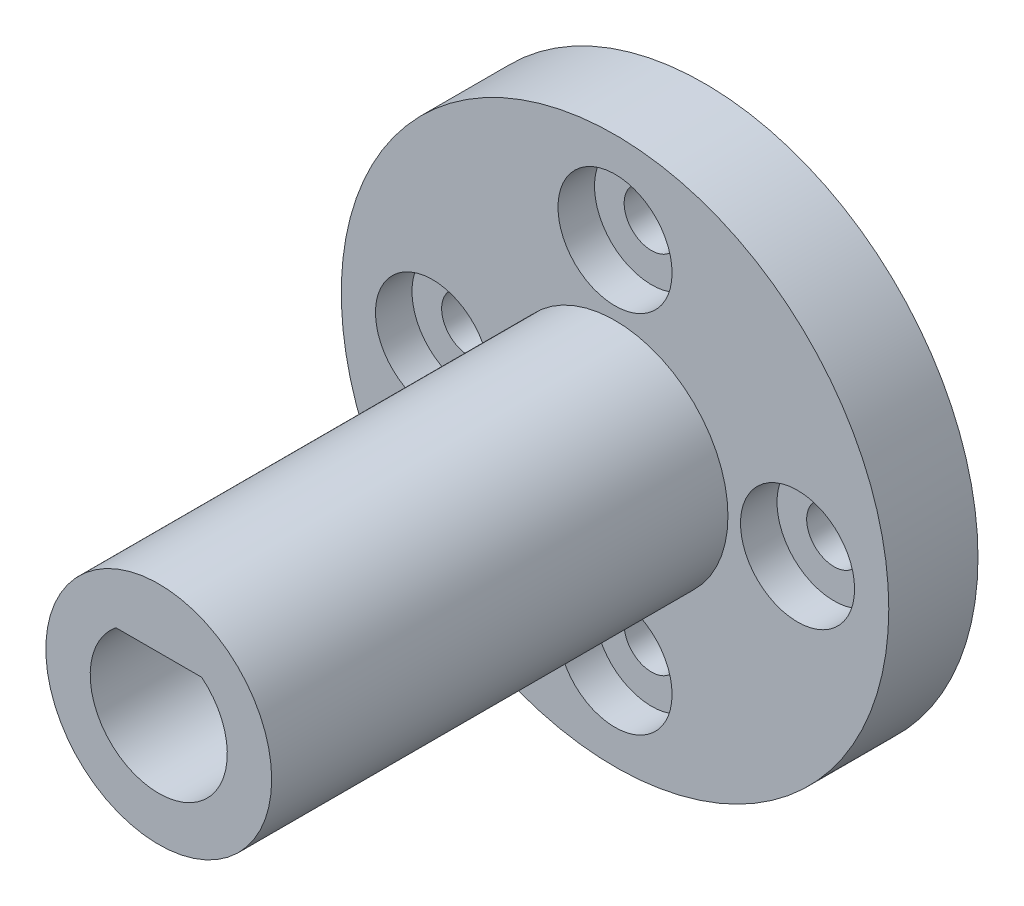
from build123d import *

# Parameters (mm, degrees)
ESQUISSE1_R                                        = 12
BOSS_EXTRU_1_DEPTH                                 = 3.91
ESQUISSE6_R                                        = 4
ENL_V_MAT_EXTRU_2_DEPTH                            = 1.91
ESQUISSE7_R                                        = 4.95
BOSS_EXTRU_2_DEPTH                                 = 20
CHAMBRAGE_POUR_VIS_T_TE_RONDE_BOMB_E_M_D           = 2.4
CHAMBRAGE_POUR_VIS_T_TE_RONDE_BOMB_E_M_CBORE_D     = 5
CHAMBRAGE_POUR_VIS_T_TE_RONDE_BOMB_E_M_CBORE_DEPTH = 1.6
R_P_TITION_CIRCULAIRE2_COUNT                       = 4


with BuildPart() as part:
    # Esquisse1 → Boss.-Extru.1 (new body)
    with BuildSketch(Plane.XY):
        Circle(ESQUISSE1_R)
    extrude(amount=BOSS_EXTRU_1_DEPTH)

    # Esquisse6 → Enlèv. mat.-Extru.2 (cut)
    with BuildSketch(Plane(origin=(0, 0, 0), x_dir=(-1, 0, 0), z_dir=(0, 0, -1))):
        Circle(ESQUISSE6_R)
    extrude(amount=-ENL_V_MAT_EXTRU_2_DEPTH, mode=Mode.SUBTRACT)

    # Esquisse7 → Boss.-Extru.2 (add)
    with BuildSketch(Plane.XY.offset(3.91)):
        Circle(ESQUISSE7_R)
        with BuildLine():
            Line((1.879095527, 2.345), (-1.879095527, 2.345))
            ThreePointArc((-1.879095527, 2.345), (0, -3.005), (1.879095527, 2.345))
        make_face(mode=Mode.SUBTRACT)
    extrude(amount=BOSS_EXTRU_2_DEPTH)

    # Chambrage pour vis à tête ronde bombée M21 (through all)
    with Locations(Plane.XY.offset(3.91)):
        with Locations((0, 8)):
            chambrage_pour_vis_t_te_ronde_bomb_e_m = CounterBoreHole(CHAMBRAGE_POUR_VIS_T_TE_RONDE_BOMB_E_M_D / 2, CHAMBRAGE_POUR_VIS_T_TE_RONDE_BOMB_E_M_CBORE_D / 2, CHAMBRAGE_POUR_VIS_T_TE_RONDE_BOMB_E_M_CBORE_DEPTH)

    # Répétition circulaire2: Chambrage pour vis à tête ronde bombée M21 ×4 about axis
    r_p_tition_circulaire2_axis = Axis((0, 0, 0), (0, 0, 1))
    for i in range(1, R_P_TITION_CIRCULAIRE2_COUNT):
        add(chambrage_pour_vis_t_te_ronde_bomb_e_m.rotate(r_p_tition_circulaire2_axis, i * 360 / R_P_TITION_CIRCULAIRE2_COUNT), mode=Mode.SUBTRACT)


solid = part.part
